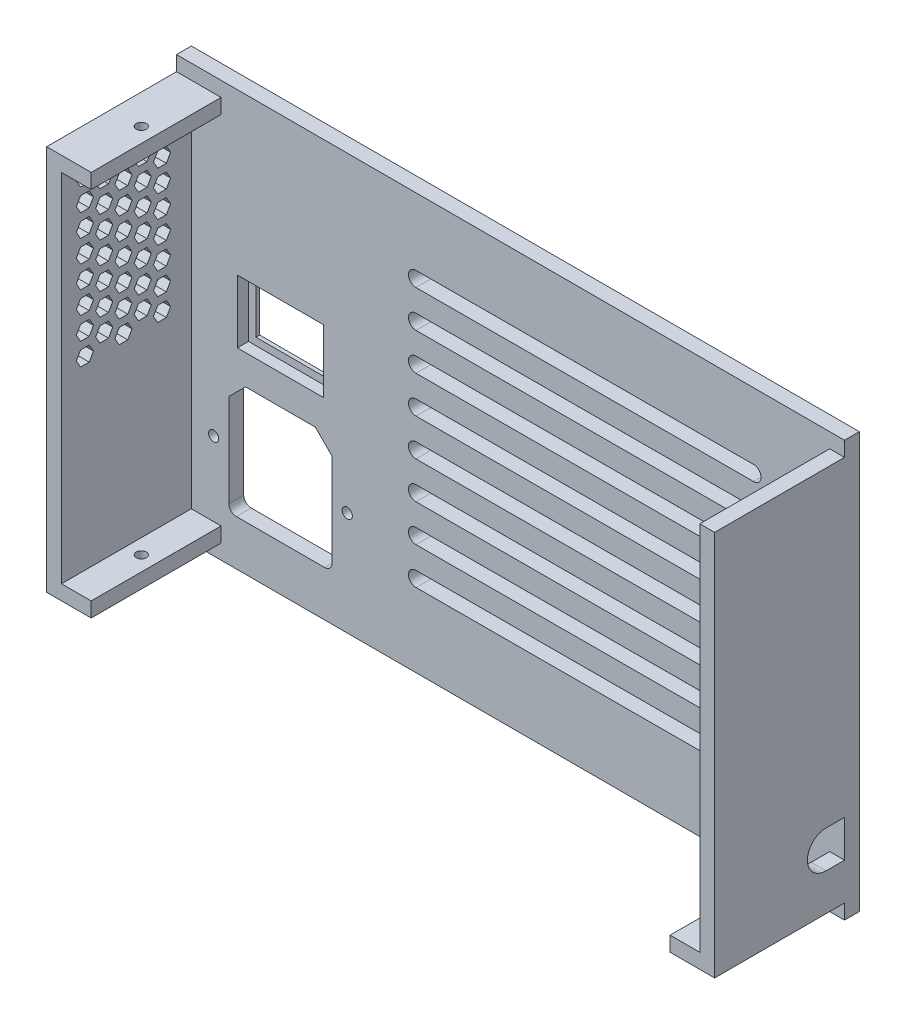
from build123d import *

# Parameters (mm, degrees)
SKICA1_W                  = 180
SKICA1_H                  = 112
P_IDAT_VYSUNUT_M1_DEPTH   = 4
SKICA2_W                  = 4
SKICA2_H                  = 104
P_IDAT_VYSUNUT_M2_DEPTH   = 35
SKICA3_W                  = 8
SKICA3_H                  = 4
P_IDAT_VYSUNUT_M3_DEPTH   = 35
ODEBRAT_VYSUNUT_M2_REACH  = 147.894
SKICA5_R                  = 1.35
ODEBRAT_VYSUNUT_M4_DEPTH  = 4
ODEBRAT_VYSUNUT_M5_DEPTH  = 4
ODEBRAT_VYSUNUT_M9_DEPTH  = 4
SKICA15_R                 = 1.375
SKICA15_W                 = 27.8
SKICA15_H                 = 31.5
ODEBRAT_VYSUNUT_M10_DEPTH = 4
ZKOSEN_1_SIZE             = 4.5
ZAOBLIT1_R                = 2
SKICA18_W                 = 19.2
SKICA18_H                 = 13
ODEBRAT_VYSUNUT_M11_DEPTH = 4
SKICA19_W                 = 23.2
SKICA19_H                 = 17
ODEBRAT_VYSUNUT_M12_DEPTH = 3


with BuildPart() as part:
    # Skica1 → Přidat vysunutím1 (new body)
    with BuildSketch(Plane.XY):
        Rectangle(SKICA1_W, SKICA1_H)
    extrude(amount=P_IDAT_VYSUNUT_M1_DEPTH)

    # Skica2 → Přidat vysunutím2 (add)
    with BuildSketch(Plane.XY.offset(4)):
        with Locations((-88, 0)):
            Rectangle(SKICA2_W, SKICA2_H)
        with Locations((88, 0)):
            Rectangle(SKICA2_W, SKICA2_H)
    extrude(amount=P_IDAT_VYSUNUT_M2_DEPTH)

    # Skica3 → Přidat vysunutím3 (add)
    with BuildSketch(Plane.XY.offset(4)):
        with Locations((-82, 50)):
            Rectangle(SKICA3_W, SKICA3_H)
        with Locations((82, -50)):
            Rectangle(SKICA3_W, SKICA3_H)
        with Locations((-82, -50)):
            Rectangle(SKICA3_W, SKICA3_H)
    extrude(amount=P_IDAT_VYSUNUT_M3_DEPTH)

    # Odebrat vysunutím2: up to this face of the body (flat: up to its plane)
    odebrat_vysunut_m2_end = Plane(part.part.faces().sort_by_distance((-84, -52, 21.5))[0])
    # Skica5 → Odebrat vysunutím2 (cut, up to the picked face)
    with BuildSketch(Plane(origin=(0, 52, 0), x_dir=(1, 0, 0), z_dir=(0, 1, 0)), mode=Mode.PRIVATE) as odebrat_vysunut_m2_sk1:
        with Locations(Location((-82, -21.5, 0), (0, 0, 270))):
            Circle(SKICA5_R)
    odebrat_vysunut_m2_tool1 = split(extrude(odebrat_vysunut_m2_sk1.sketch, amount=-ODEBRAT_VYSUNUT_M2_REACH, mode=Mode.PRIVATE), bisect_by=odebrat_vysunut_m2_end, keep=Keep.BOTH, mode=Mode.PRIVATE)
    # Skica5 → Odebrat vysunutím2 (cut, up to the picked face)
    with BuildSketch(Plane(origin=(0, 52, 0), x_dir=(1, 0, 0), z_dir=(0, 1, 0)), mode=Mode.PRIVATE) as odebrat_vysunut_m2_sk2:
        with Locations(Location((82, -21.5, 0), (0, 0, 270))):
            Circle(SKICA5_R)
    odebrat_vysunut_m2_tool2 = split(extrude(odebrat_vysunut_m2_sk2.sketch, amount=-ODEBRAT_VYSUNUT_M2_REACH, mode=Mode.PRIVATE), bisect_by=odebrat_vysunut_m2_end, keep=Keep.BOTH, mode=Mode.PRIVATE)
    add(odebrat_vysunut_m2_tool1.solids().sort_by(Axis((-82, 52, 21.5), (0, -1, 0)))[0], mode=Mode.SUBTRACT)
    add(odebrat_vysunut_m2_tool2.solids().sort_by(Axis((82, 52, 21.5), (0, -1, 0)))[0], mode=Mode.SUBTRACT)

    # Skica8 → Odebrat vysunutím4 (cut)
    with BuildSketch(Plane.ZY.offset(-86)):
        with BuildLine():
            Line((9, -42), (4, -42))
            Line((4, -42), (4, -32))
            Line((4, -32), (9, -32))
            ThreePointArc((9, -32), (14, -37), (9, -42))
        make_face()
    extrude(amount=-ODEBRAT_VYSUNUT_M4_DEPTH, mode=Mode.SUBTRACT)

    # Skica9 → Odebrat vysunutím5 (cut)
    with BuildSketch(Plane.XY.offset(4)):
        with BuildLine():
            Line((-25.504552244, 37.893601095), (65.495198974, 38.10638797))
            ThreePointArc((65.495198974, 38.10638797), (67.499870141, 36.111070072), (65.504552244, 34.106398905))
            Line((65.504552244, 34.106398905), (-25.495198974, 33.89361203))
            ThreePointArc((-25.495198974, 33.89361203), (-27.499870141, 35.888929928), (-25.504552244, 37.893601095))
        make_face()
        with BuildLine():
            Line((-25.504552244, 27.893601095), (65.495198974, 28.10638797))
            ThreePointArc((65.495198974, 28.10638797), (67.499870141, 26.111070072), (65.504552244, 24.106398905))
            Line((65.504552244, 24.106398905), (-25.495198974, 23.89361203))
            ThreePointArc((-25.495198974, 23.89361203), (-27.499870141, 25.888929928), (-25.504552244, 27.893601095))
        make_face()
        with BuildLine():
            Line((-25.504552244, 17.893601095), (65.495198974, 18.10638797))
            ThreePointArc((65.495198974, 18.10638797), (67.499870141, 16.111070072), (65.504552244, 14.106398905))
            Line((65.504552244, 14.106398905), (-25.495198974, 13.89361203))
            ThreePointArc((-25.495198974, 13.89361203), (-27.499870141, 15.888929928), (-25.504552244, 17.893601095))
        make_face()
        with BuildLine():
            Line((-25.504552244, 7.893601095), (65.495198974, 8.10638797))
            ThreePointArc((65.495198974, 8.10638797), (67.499870141, 6.111070072), (65.504552244, 4.106398905))
            Line((65.504552244, 4.106398905), (-25.495198974, 3.89361203))
            ThreePointArc((-25.495198974, 3.89361203), (-27.499870141, 5.888929928), (-25.504552244, 7.893601095))
        make_face()
        with BuildLine():
            Line((-25.504552244, -2.106398905), (65.495198974, -1.89361203))
            ThreePointArc((65.495198974, -1.89361203), (67.499870141, -3.888929928), (65.504552244, -5.893601095))
            Line((65.504552244, -5.893601095), (-25.495198974, -6.10638797))
            ThreePointArc((-25.495198974, -6.10638797), (-27.499870141, -4.111070072), (-25.504552244, -2.106398905))
        make_face()
        with BuildLine():
            Line((-25.504552244, -12.106398905), (65.495198974, -11.89361203))
            ThreePointArc((65.495198974, -11.89361203), (67.499870141, -13.888929928), (65.504552244, -15.893601095))
            Line((65.504552244, -15.893601095), (-25.495198974, -16.10638797))
            ThreePointArc((-25.495198974, -16.10638797), (-27.499870141, -14.111070072), (-25.504552244, -12.106398905))
        make_face()
        with BuildLine():
            Line((-25.504552244, -22.106398905), (65.495198974, -21.89361203))
            ThreePointArc((65.495198974, -21.89361203), (67.499870141, -23.888929928), (65.504552244, -25.893601095))
            Line((65.504552244, -25.893601095), (-25.495198974, -26.10638797))
            ThreePointArc((-25.495198974, -26.10638797), (-27.499870141, -24.111070072), (-25.504552244, -22.106398905))
        make_face()
        with BuildLine():
            Line((-25.504552244, -32.106398905), (65.495198974, -31.89361203))
            ThreePointArc((65.495198974, -31.89361203), (67.499870141, -33.888929928), (65.504552244, -35.893601095))
            Line((65.504552244, -35.893601095), (-25.495198974, -36.10638797))
            ThreePointArc((-25.495198974, -36.10638797), (-27.499870141, -34.111070072), (-25.504552244, -32.106398905))
        make_face()
    extrude(amount=-ODEBRAT_VYSUNUT_M5_DEPTH, mode=Mode.SUBTRACT)

    # Skica13 → Odebrat vysunutím9 (cut)
    with BuildSketch(Plane.ZY.offset(90)):
        Polygon((35, 44), (33.845299462, 46), (31.535898385, 46), (30.381197846, 44), (31.535898385, 42), (33.845299462, 42), align=None)
        Polygon((29.803847577, 41), (28.649147039, 43), (26.339745962, 43), (25.185045424, 41), (26.339745962, 39), (28.649147039, 39), align=None)
        Polygon((35, 32), (33.845299462, 34), (31.535898385, 34), (30.381197846, 32), (31.535898385, 30), (33.845299462, 30), align=None)
        Polygon((35, 38), (33.845299462, 40), (31.535898385, 40), (30.381197846, 38), (31.535898385, 36), (33.845299462, 36), align=None)
        Polygon((29.803847577, 35), (28.649147039, 37), (26.339745962, 37), (25.185045424, 35), (26.339745962, 33), (28.649147039, 33), align=None)
        Polygon((35, 26), (33.845299462, 28), (31.535898385, 28), (30.381197846, 26), (31.535898385, 24), (33.845299462, 24), align=None)
        Polygon((29.803847577, 29), (28.649147039, 31), (26.339745962, 31), (25.185045424, 29), (26.339745962, 27), (28.649147039, 27), align=None)
        Polygon((29.803847577, 23), (28.649147039, 25), (26.339745962, 25), (25.185045424, 23), (26.339745962, 21), (28.649147039, 21), align=None)
        Polygon((35, 20), (33.845299462, 22), (31.535898385, 22), (30.381197846, 20), (31.535898385, 18), (33.845299462, 18), align=None)
        Polygon((35, 14), (33.845299462, 16), (31.535898385, 16), (30.381197846, 14), (31.535898385, 12), (33.845299462, 12), align=None)
        Polygon((29.803847577, 17), (28.649147039, 19), (26.339745962, 19), (25.185045424, 17), (26.339745962, 15), (28.649147039, 15), align=None)
        Polygon((29.803847577, 11), (28.649147039, 13), (26.339745962, 13), (25.185045424, 11), (26.339745962, 9), (28.649147039, 9), align=None)
        Polygon((35, 8), (33.845299462, 10), (31.535898385, 10), (30.381197846, 8), (31.535898385, 6), (33.845299462, 6), align=None)
        Polygon((35, 2), (33.845299462, 4), (31.535898385, 4), (30.381197846, 2), (31.535898385, 0), (33.845299462, 0), align=None)
        Polygon((29.803847577, 5), (28.649147039, 7), (26.339745962, 7), (25.185045424, 5), (26.339745962, 3), (28.649147039, 3), align=None)
        Polygon((24.61, 44), (23.455299462, 46), (21.145898385, 46), (19.991197846, 44), (21.145898385, 42), (23.455299462, 42), align=None)
        Polygon((19.413847577, 41), (18.259147039, 43), (15.949745962, 43), (14.795045424, 41), (15.949745962, 39), (18.259147039, 39), align=None)
        Polygon((24.61, 38), (23.455299462, 40), (21.145898385, 40), (19.991197846, 38), (21.145898385, 36), (23.455299462, 36), align=None)
        Polygon((19.413847577, 35), (18.259147039, 37), (15.949745962, 37), (14.795045424, 35), (15.949745962, 33), (18.259147039, 33), align=None)
        Polygon((24.61, 32), (23.455299462, 34), (21.145898385, 34), (19.991197846, 32), (21.145898385, 30), (23.455299462, 30), align=None)
        Polygon((19.413847577, 29), (18.259147039, 31), (15.949745962, 31), (14.795045424, 29), (15.949745962, 27), (18.259147039, 27), align=None)
        Polygon((24.61, 26), (23.455299462, 28), (21.145898385, 28), (19.991197846, 26), (21.145898385, 24), (23.455299462, 24), align=None)
        Polygon((19.413847577, 23), (18.259147039, 25), (15.949745962, 25), (14.795045424, 23), (15.949745962, 21), (18.259147039, 21), align=None)
        Polygon((24.61, 20), (23.455299462, 22), (21.145898385, 22), (19.991197846, 20), (21.145898385, 18), (23.455299462, 18), align=None)
        Polygon((19.413847577, 17), (18.259147039, 19), (15.949745962, 19), (14.795045424, 17), (15.949745962, 15), (18.259147039, 15), align=None)
        Polygon((24.61, 14), (23.455299462, 16), (21.145898385, 16), (19.991197846, 14), (21.145898385, 12), (23.455299462, 12), align=None)
        Polygon((19.413847577, 11), (18.259147039, 13), (15.949745962, 13), (14.795045424, 11), (15.949745962, 9), (18.259147039, 9), align=None)
        Polygon((24.61, 8), (23.455299462, 10), (21.145898385, 10), (19.991197846, 8), (21.145898385, 6), (23.455299462, 6), align=None)
        Polygon((19.413847577, 5), (18.259147039, 7), (15.949745962, 7), (14.795045424, 5), (15.949745962, 3), (18.259147039, 3), align=None)
        Polygon((24.61, 2), (23.455299462, 4), (21.145898385, 4), (19.991197846, 2), (21.145898385, 0), (23.455299462, 0), align=None)
        Polygon((14.22, 44), (13.065299462, 46), (10.755898385, 46), (9.601197846, 44), (10.755898385, 42), (13.065299462, 42), align=None)
        Polygon((14.22, 38), (13.065299462, 40), (10.755898385, 40), (9.601197846, 38), (10.755898385, 36), (13.065299462, 36), align=None)
        Polygon((14.22, 32), (13.065299462, 34), (10.755898385, 34), (9.601197846, 32), (10.755898385, 30), (13.065299462, 30), align=None)
        Polygon((14.22, 26), (13.065299462, 28), (10.755898385, 28), (9.601197846, 26), (10.755898385, 24), (13.065299462, 24), align=None)
        Polygon((14.22, 20), (13.065299462, 22), (10.755898385, 22), (9.601197846, 20), (10.755898385, 18), (13.065299462, 18), align=None)
        Polygon((14.22, 14), (13.065299462, 16), (10.755898385, 16), (9.601197846, 14), (10.755898385, 12), (13.065299462, 12), align=None)
        Polygon((14.22, 8), (13.065299462, 10), (10.755898385, 10), (9.601197846, 8), (10.755898385, 6), (13.065299462, 6), align=None)
        Polygon((14.22, 2), (13.065299462, 4), (10.755898385, 4), (9.601197846, 2), (10.755898385, 0), (13.065299462, 0), align=None)
    extrude(amount=-ODEBRAT_VYSUNUT_M9_DEPTH, mode=Mode.SUBTRACT)

    # Skica15 → Odebrat vysunutím10 (cut)
    with BuildSketch(Plane.XY.offset(4)):
        with Locations((-80, -28)):
            Circle(SKICA15_R)
        with Locations((-44, -28)):
            Circle(SKICA15_R)
        with Locations((-62, -28)):
            Rectangle(SKICA15_W, SKICA15_H)
    extrude(amount=-ODEBRAT_VYSUNUT_M10_DEPTH, mode=Mode.SUBTRACT)

    # Zkosení1
    zkosen_1_edges = [part.edges().sort_by_distance(p)[0] for p in [
        (-75.9, -12.25, 2),
        (-48.1, -12.25, 2),
    ]]
    chamfer(zkosen_1_edges, length=ZKOSEN_1_SIZE)

    # Zaoblit1
    zaoblit1_edges = [part.edges().sort_by_distance(p)[0] for p in [
        (-75.9, -43.75, 2),
        (-48.1, -43.75, 2),
    ]]
    fillet(zaoblit1_edges, radius=ZAOBLIT1_R)

    # Skica18 → Odebrat vysunutím11 (cut)
    with BuildSketch(Plane.XY.offset(4)):
        with Locations((-62, 4.25)):
            Rectangle(SKICA18_W, SKICA18_H)
    extrude(amount=-ODEBRAT_VYSUNUT_M11_DEPTH, mode=Mode.SUBTRACT)

    # Skica19 → Odebrat vysunutím12 (cut)
    with BuildSketch(Plane.XY.offset(4)):
        with Locations((-62, 4.25)):
            Rectangle(SKICA19_W, SKICA19_H)
    extrude(amount=-ODEBRAT_VYSUNUT_M12_DEPTH, mode=Mode.SUBTRACT)


solid = part.part
